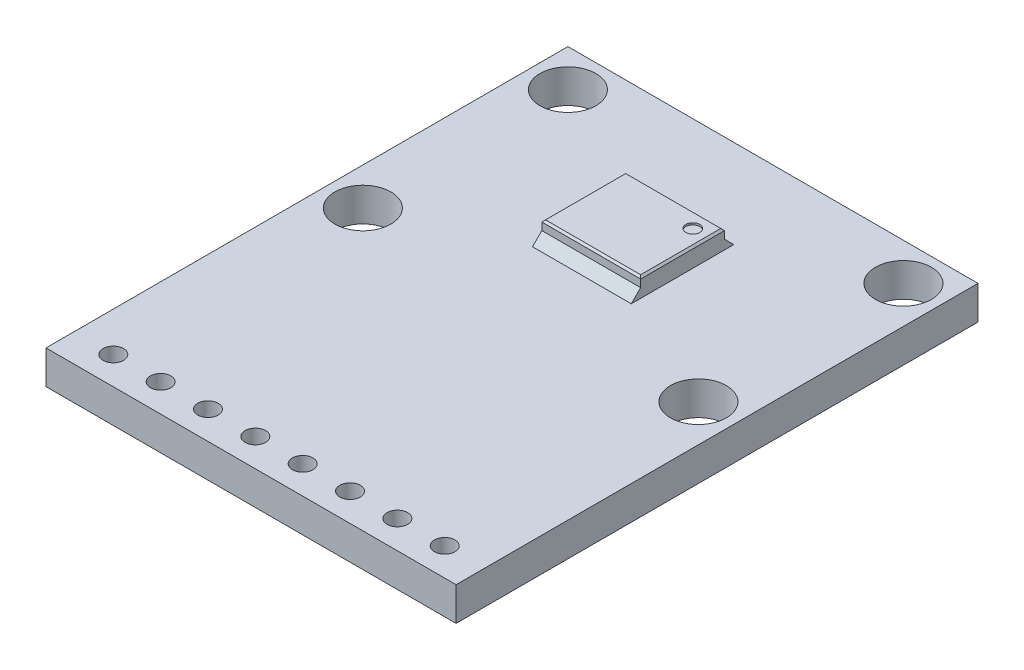
from build123d import *

# Parameters (mm, degrees)
SKETCH1_W           = 22
SKETCH1_H           = 28
SKETCH1_R           = 1.5
SKETCH1_R_2         = 0.55
BOSS_EXTRUDE1_DEPTH = 1.8
SKETCH2_W           = 5.3
SKETCH2_H           = 4.5
BOSS_EXTRUDE2_DEPTH = 1
CHAMFER1_SIZE       = 0.5
CHAMFER2_SIZE       = 0.1
SKETCH3_R           = 0.375
CUT_EXTRUDE1_DEPTH  = 0.1


with BuildPart() as part:
    # Sketch1 → Boss-Extrude1 (new body)
    with BuildSketch(Plane(origin=(0, 0, 0), x_dir=(1, 0, 0), z_dir=(0, 1, 0))):
        Rectangle(SKETCH1_W, SKETCH1_H)
        with Locations(Location((-9, 12, 0), (0, 0, 270))):
            Circle(SKETCH1_R, mode=Mode.SUBTRACT)
        with Locations(Location((9, 12, 0), (0, 0, 270))):
            Circle(SKETCH1_R, mode=Mode.SUBTRACT)
        with Locations(Location((9, 1, 0), (0, 0, 270))):
            Circle(SKETCH1_R, mode=Mode.SUBTRACT)
        with Locations(Location((-9, 1, 0), (0, 0, 270))):
            Circle(SKETCH1_R, mode=Mode.SUBTRACT)
        with Locations(Location((-8.89, -12.5, 0), (0, 0, 270))):
            Circle(SKETCH1_R_2, mode=Mode.SUBTRACT)
        with Locations(Location((-6.35, -12.5, 0), (0, 0, 270))):
            Circle(SKETCH1_R_2, mode=Mode.SUBTRACT)
        with Locations(Location((-3.81, -12.5, 0), (0, 0, 270))):
            Circle(SKETCH1_R_2, mode=Mode.SUBTRACT)
        with Locations(Location((-1.27, -12.5, 0), (0, 0, 270))):
            Circle(SKETCH1_R_2, mode=Mode.SUBTRACT)
        with Locations(Location((1.27, -12.5, 0), (0, 0, 270))):
            Circle(SKETCH1_R_2, mode=Mode.SUBTRACT)
        with Locations(Location((3.81, -12.5, 0), (0, 0, 270))):
            Circle(SKETCH1_R_2, mode=Mode.SUBTRACT)
        with Locations(Location((6.35, -12.5, 0), (0, 0, 270))):
            Circle(SKETCH1_R_2, mode=Mode.SUBTRACT)
        with Locations(Location((8.89, -12.5, 0), (0, 0, 270))):
            Circle(SKETCH1_R_2, mode=Mode.SUBTRACT)
    extrude(amount=BOSS_EXTRUDE1_DEPTH)

    # Sketch2 → Boss-Extrude2 (add)
    with BuildSketch(Plane(origin=(0, 1.8, 0), x_dir=(1, 0, 0), z_dir=(0, 1, 0))):
        with Locations((0, 6.5)):
            Rectangle(SKETCH2_W, SKETCH2_H)
    extrude(amount=BOSS_EXTRUDE2_DEPTH)

    # Chamfer1
    chamfer1_edges = [part.edges().sort_by_distance(p)[0] for p in [
        (0, 1.8, -8.75),
        (0, 1.8, -4.25),
    ]]
    chamfer(chamfer1_edges, length=CHAMFER1_SIZE)

    # Chamfer2
    chamfer2_edges = [part.edges().sort_by_distance(p)[0] for p in [
        (2.65, 2.8, -6.5),
        (0, 2.8, -8.75),
        (-2.65, 2.8, -6.5),
        (0, 2.8, -4.25),
    ]]
    chamfer(chamfer2_edges, length=CHAMFER2_SIZE)

    # Sketch3 → Cut-Extrude1 (cut)
    with BuildSketch(Plane(origin=(0, 2.8, 0), x_dir=(1, 0, 0), z_dir=(0, 1, 0))):
        with Locations(Location((1.8, 7.9, 0), (0, 0, 270))):
            Circle(SKETCH3_R)
    extrude(amount=-CUT_EXTRUDE1_DEPTH, mode=Mode.SUBTRACT)


solid = part.part
